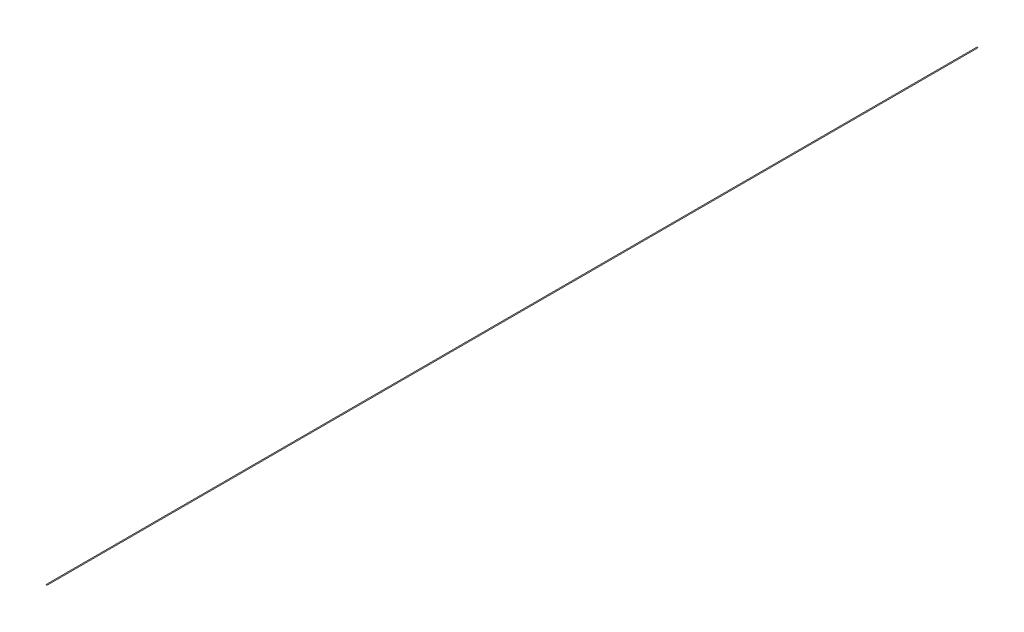
from build123d import *

# Parameters (mm, degrees)
EXTRUDE_1_DEPTH = 50000


with BuildPart() as part:
    # 草图1 → 凸台-拉伸1 (new body)
    with BuildSketch(Plane.XY):
        Polygon((0, 34.641), (-30, 0), (30, 0), align=None)
    extrude(amount=EXTRUDE_1_DEPTH)


solid = part.part
